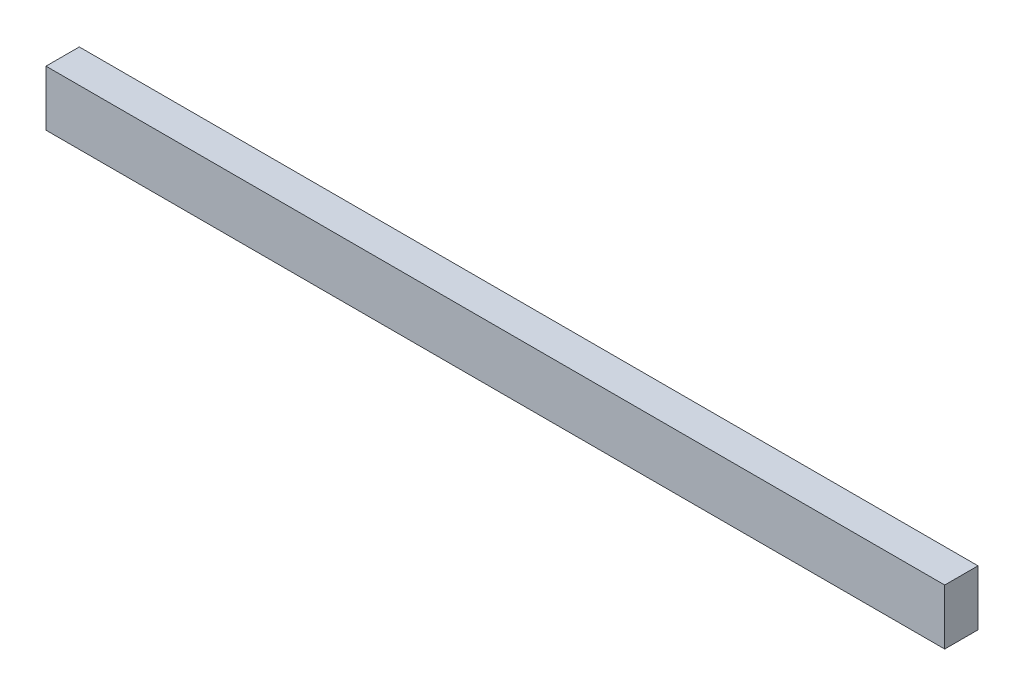
from build123d import *

# Parameters (mm, degrees)
SKETCH1_W                        = 514.35
SKETCH1_H                        = 19.05
BOSS_EXTRUDE1_DEPTH              = 31.75
F_1_8_0_125_DIAMETER_HOLE1_D     = 3.175
F_1_8_0_125_DIAMETER_HOLE1_DEPTH = 11.1125
F_1_8_0_125_DIAMETER_HOLE1_TIP   = 0.953866233


with BuildPart() as part:
    # Sketch1 → Boss-Extrude1 (new body)
    with BuildSketch(Plane(origin=(0, 0, 0), x_dir=(1, 0, 0), z_dir=(0, 1, 0))):
        Rectangle(SKETCH1_W, SKETCH1_H)
    extrude(amount=BOSS_EXTRUDE1_DEPTH)

    # 1/8 (0.125) Diameter Hole1
    with Locations(Plane(origin=(0, 0, -9.525), x_dir=(-1, 0, 0), z_dir=(0, 0, -1))):
        with Locations((-171.45, 15.875), (-85.725, 15.875), (0, 15.875), (85.725, 15.875), (171.45, 15.875)):
            Hole(F_1_8_0_125_DIAMETER_HOLE1_D / 2, depth=F_1_8_0_125_DIAMETER_HOLE1_DEPTH)
            with Locations((0, 0, -(F_1_8_0_125_DIAMETER_HOLE1_DEPTH + F_1_8_0_125_DIAMETER_HOLE1_TIP / 2))):  # 118° drill point
                Cone(0, F_1_8_0_125_DIAMETER_HOLE1_D / 2, F_1_8_0_125_DIAMETER_HOLE1_TIP, mode=Mode.SUBTRACT)


solid = part.part
